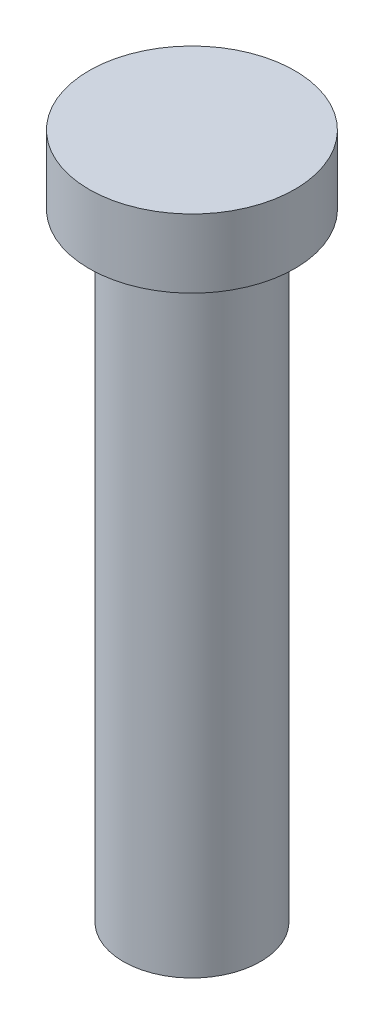
from build123d import *

# Parameters (mm, degrees)
SKETCH1_R           = 1
BOSS_EXTRUDE1_DEPTH = 9
SKETCH2_R           = 1.5
BOSS_EXTRUDE2_DEPTH = 1


with BuildPart() as part:
    # Sketch1 → Boss-Extrude1 (new body)
    with BuildSketch(Plane(origin=(0, 0, 0), x_dir=(1, 0, 0), z_dir=(0, 1, 0))):
        with Locations(Location((0, 0, 0), (0, 0, 270))):
            Circle(SKETCH1_R)
    extrude(amount=BOSS_EXTRUDE1_DEPTH)

    # Sketch2 → Boss-Extrude2 (add)
    with BuildSketch(Plane(origin=(0, 9, 0), x_dir=(1, 0, 0), z_dir=(0, 1, 0))):
        with Locations(Location((0, 0, 0), (0, 0, 270))):
            Circle(SKETCH2_R)
    extrude(amount=BOSS_EXTRUDE2_DEPTH)


solid = part.part
